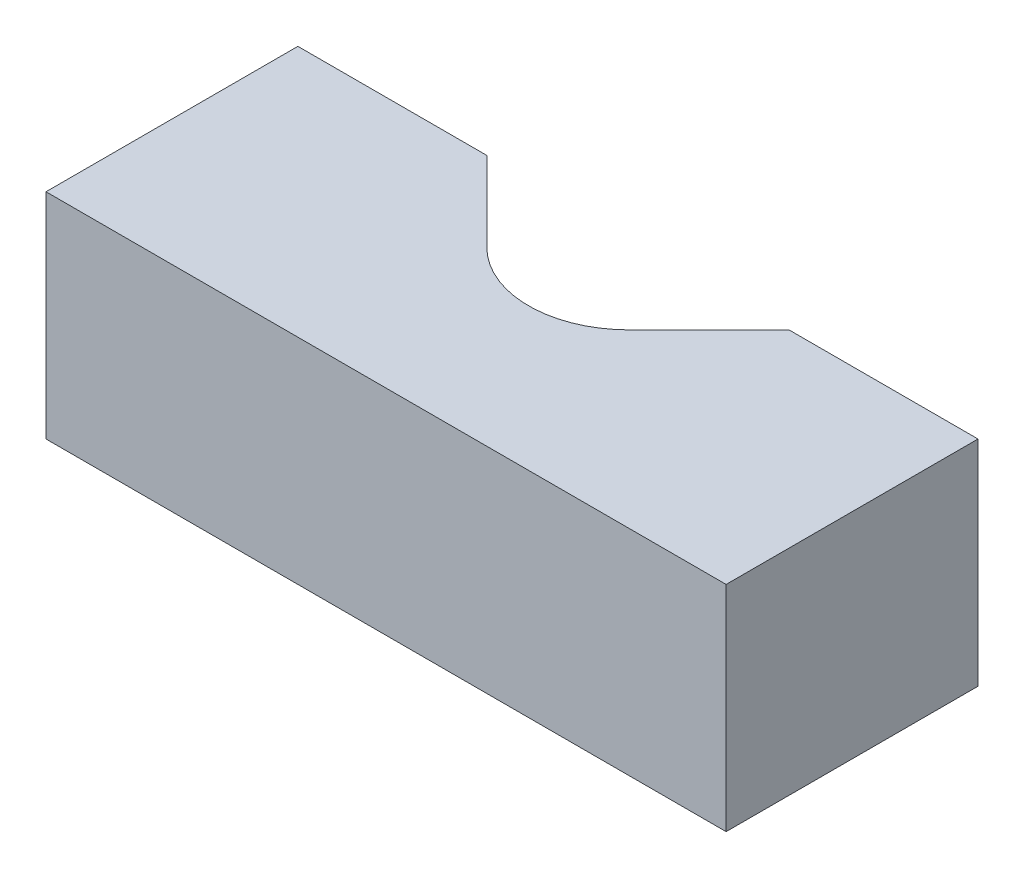
from build123d import *

# Parameters (mm, degrees)
BOSS_EXTRUDE1_DEPTH = 10.795
FILLET1_R           = 5.08


with BuildPart() as part:
    # Sketch1 → Boss-Extrude1 (new body)
    with BuildSketch(Plane(origin=(0, 0, 0), x_dir=(1, 0, 0), z_dir=(0, 1, 0))):
        Polygon((7.617900731, -1.524), (0, -9.141900731), (-7.617900731, -1.524), (-17.142900731, -1.524), (-17.142900731, -14.221900731), (17.142900731, -14.221900731), (17.142900731, -1.524), align=None)
    extrude(amount=BOSS_EXTRUDE1_DEPTH)

    # Fillet1
    fillet1_edges = [part.edges().sort_by_distance(p)[0] for p in [
        (0, 5.3975, 9.141900731),
    ]]
    fillet(fillet1_edges, radius=FILLET1_R)


solid = part.part
